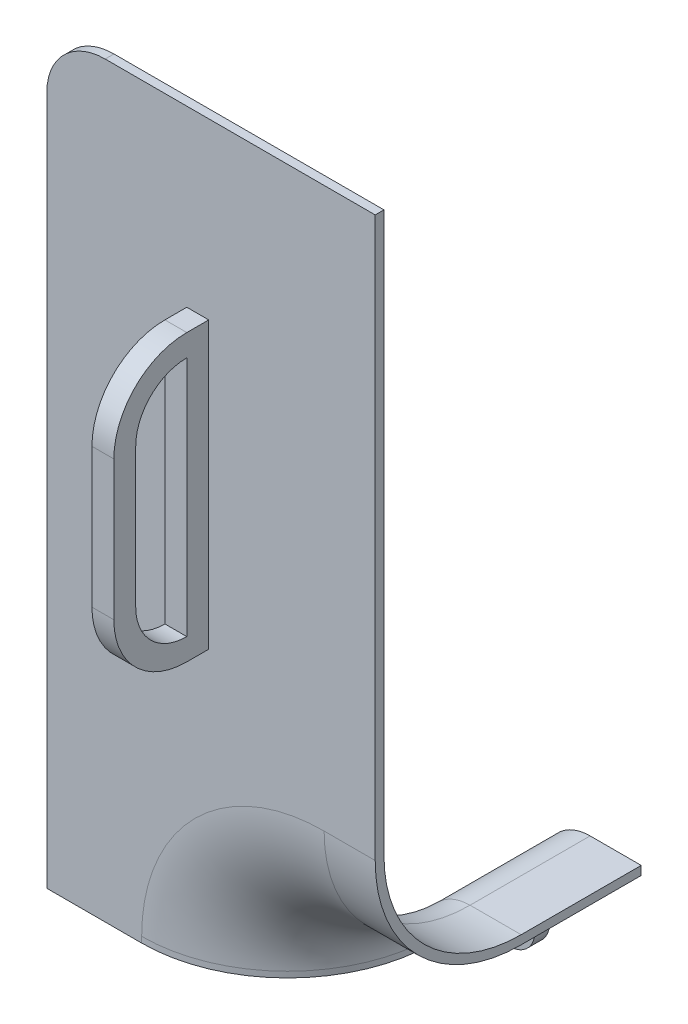
from build123d import *

# Parameters (mm, degrees)
BOSS_EXTRUDE1_DEPTH = 36.45
FILLET1_R           = 5
FILLET2_R           = 20
SHELL2_T            = -1.2
BOSS_EXTRUDE2_START = 2
SKETCH3_R           = 1.5
BOSS_EXTRUDE2_DEPTH = 2
SKETCH4_W           = 3
SKETCH4_H           = 39.083354503
BOSS_EXTRUDE3_DEPTH = 13
FILLET3_R           = 10
CUT_EXTRUDE1_DEPTH  = 13


with BuildPart() as part:
    # Sketch1 → Boss-Extrude1 (new body)
    with BuildSketch(Plane.XY):
        with BuildLine():
            Line((-72.731515082, -496.215408036), (-35.731515082, -496.215408036))
            Line((-35.731515082, -496.215408036), (-35.731515082, -592.831160904))
            Line((-35.731515082, -592.831160904), (-47.731515082, -592.831160904))
            Line((-47.731515082, -592.831160904), (-47.731515082, -598.627239774))
            Line((-47.731515082, -598.627239774), (-80.731515082, -598.627239774))
            Line((-80.731515082, -598.627239774), (-80.731515082, -504.215408036))
            ThreePointArc((-80.731515082, -504.215408036), (-78.388369332, -498.558553786), (-72.731515082, -496.215408036))
        make_face()
    extrude(amount=BOSS_EXTRUDE1_DEPTH)

    # Fillet1
    fillet1_edges = [part.edges().sort_by_distance(p)[0] for p in [
        (-47.731515082, -592.831160904, 18.225),
    ]]
    fillet(fillet1_edges, radius=FILLET1_R)

    # Fillet2
    fillet2_edges = [part.edges().sort_by_distance(p)[0] for p in [
        (-39.231515082, -592.831160904, 36.45),
        (-46.267048988, -594.295626999, 36.45),
        (-47.731515082, -598.229200339, 36.45),
    ]]
    fillet(fillet2_edges, radius=FILLET2_R)

    # Shell2
    shell2_openings = [part.faces().sort_by_distance(p)[0] for p in [
        (-78.388369332, -498.558553786, 18.225),
        (-80.731515082, -551.421323905, 18.225),
        (-65.156208184, -598.627239774, 17.167742853),
        (-35.731515082, -543.427965052, 17.881276605),
        (-54.231515082, -496.215408036, 18.225),
        (-58.408271611, -546.88462098, 0),
    ]]
    offset(amount=SHELL2_T, openings=shell2_openings, kind=Kind.INTERSECTION)

    # Sketch3 → Boss-Extrude2 (add)
    with BuildSketch(Plane.XY.offset(8).offset(BOSS_EXTRUDE2_START)):
        with BuildLine():
            Line((-47.731515082, -597.831160904), (-47.731515082, -600.270500733))
            Line((-47.731515082, -600.270500733), (-43.792175254, -600.270500733))
            ThreePointArc((-43.792175254, -600.270500733), (-41.31730152, -599.245374467), (-40.292175254, -596.770500733))
            Line((-40.292175254, -596.770500733), (-40.292175254, -592.831160904))
            Line((-40.292175254, -592.831160904), (-42.731515082, -592.831160904))
            ThreePointArc((-42.731515082, -592.831160904), (-46.267048988, -594.295626999), (-47.731515082, -597.831160904))
        make_face()
        with Locations((-43.792175254, -596.770500733)):
            Circle(SKETCH3_R, mode=Mode.SUBTRACT)
    extrude(amount=-BOSS_EXTRUDE2_DEPTH)

    # Sketch4 → Boss-Extrude3 (add)
    with BuildSketch(Plane.XY.offset(36.45)):
        with Locations((-60.045293953, -539.622953905)):
            Rectangle(SKETCH4_W, SKETCH4_H)
    extrude(amount=BOSS_EXTRUDE3_DEPTH)

    # Fillet3
    fillet3_edges = [part.edges().sort_by_distance(p)[0] for p in [
        (-60.045293953, -559.164631156, 49.45),
        (-60.045293953, -520.081276653, 49.45),
    ]]
    fillet(fillet3_edges, radius=FILLET3_R)

    # Sketch5 → Cut-Extrude1 (cut)
    with BuildSketch(Plane(origin=(-58.545293953, 0, 0), x_dir=(0, 0, -1), z_dir=(1, 0, 0))):
        with BuildLine():
            Line((-39.45, -556.164631156), (-39.45, -523.081276653))
            ThreePointArc((-39.45, -523.081276653), (-44.399747468, -525.131529185), (-46.45, -530.081276653))
            Line((-46.45, -530.081276653), (-46.45, -549.164631156))
            ThreePointArc((-46.45, -549.164631156), (-44.399747468, -554.114378625), (-39.45, -556.164631156))
        make_face()
    extrude(amount=-CUT_EXTRUDE1_DEPTH, mode=Mode.SUBTRACT)


solid = part.part
